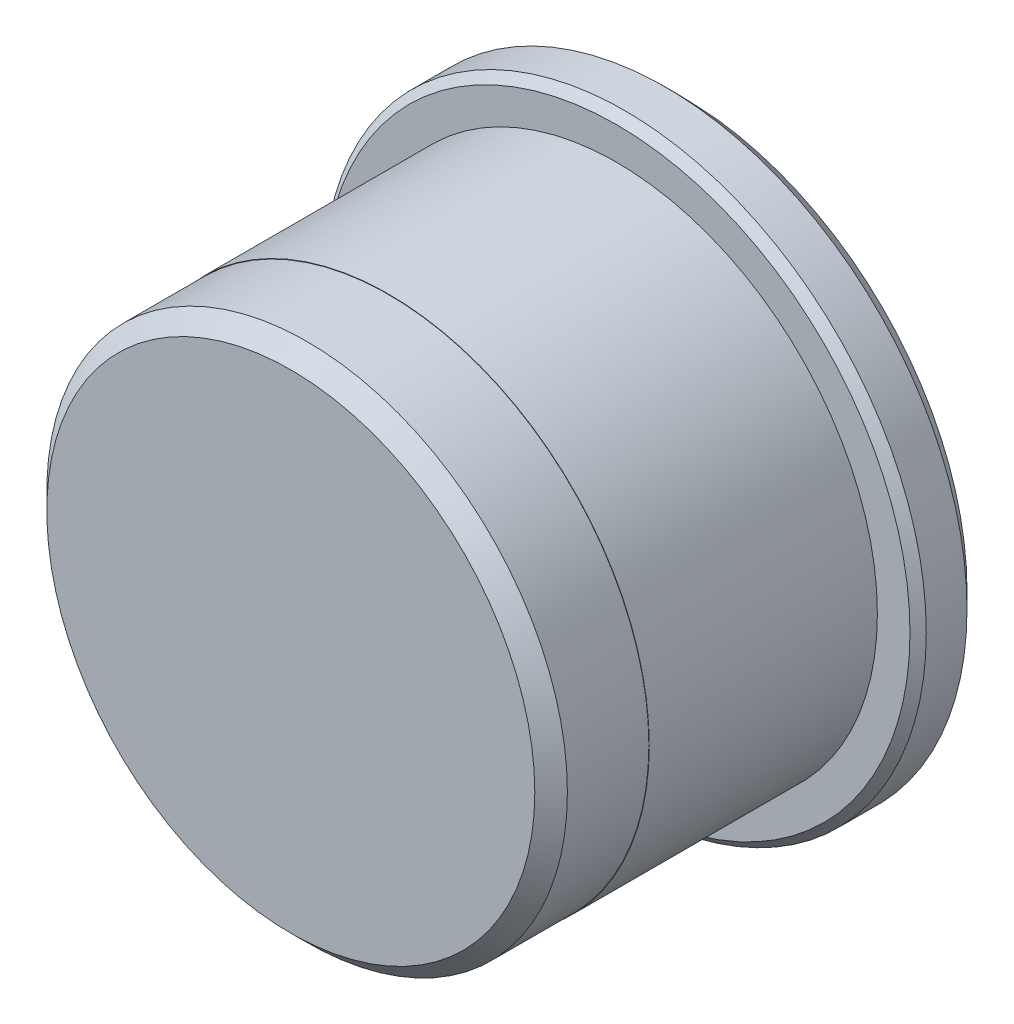
from build123d import *

# Parameters (mm, degrees)
SKETCH2_R          = 4
CUT_EXTRUDE3_DEPTH = 36.503520952
CIRPATTERN1_COUNT  = 3


with BuildPart() as part:
    # Sketch1 → Revolve2 (revolve)
    with BuildSketch(Plane(origin=(0, 0, 0), x_dir=(0, 0, -1), z_dir=(1, 0, 0)), mode=Mode.PRIVATE) as revolve2_sk:
        Polygon((0, 0), (0, 14.975), (1, 15.975), (6, 15.975), (6, 16), (20, 16), (20, 18), (20.5, 18.5), (23, 18.5), (24, 17.5), (24, 14.077350269), (23, 13.5), (9, 13.5), (9, 13.75), (7, 13.75), (7, 11), (5, 11), (5, 1.5), (4.098709071, 0), align=None)
    revolve(revolve2_sk.sketch.rotate(Axis((0, 0, 0), (0, 0, -1)), 90), axis=Axis((0, 0, 0), (0, 0, -1)))

    # Sketch2 → Cut-Extrude3 (cut, through all)
    with BuildSketch(Plane(origin=(0, 0, 0), x_dir=(0, 0, -1), z_dir=(0, 1, 0))):
        with Locations((27.3, 0)):
            Circle(SKETCH2_R)
    cut_extrude3 = extrude(amount=CUT_EXTRUDE3_DEPTH, mode=Mode.SUBTRACT)

    # CirPattern1: Cut-Extrude3 ×3 about axis
    cirpattern1_axis = Axis((0, 0, -4.098709071), (0, 0, -1))
    for i in range(1, CIRPATTERN1_COUNT):
        add(cut_extrude3.rotate(cirpattern1_axis, i * 360 / CIRPATTERN1_COUNT), mode=Mode.SUBTRACT)


solid = part.part
